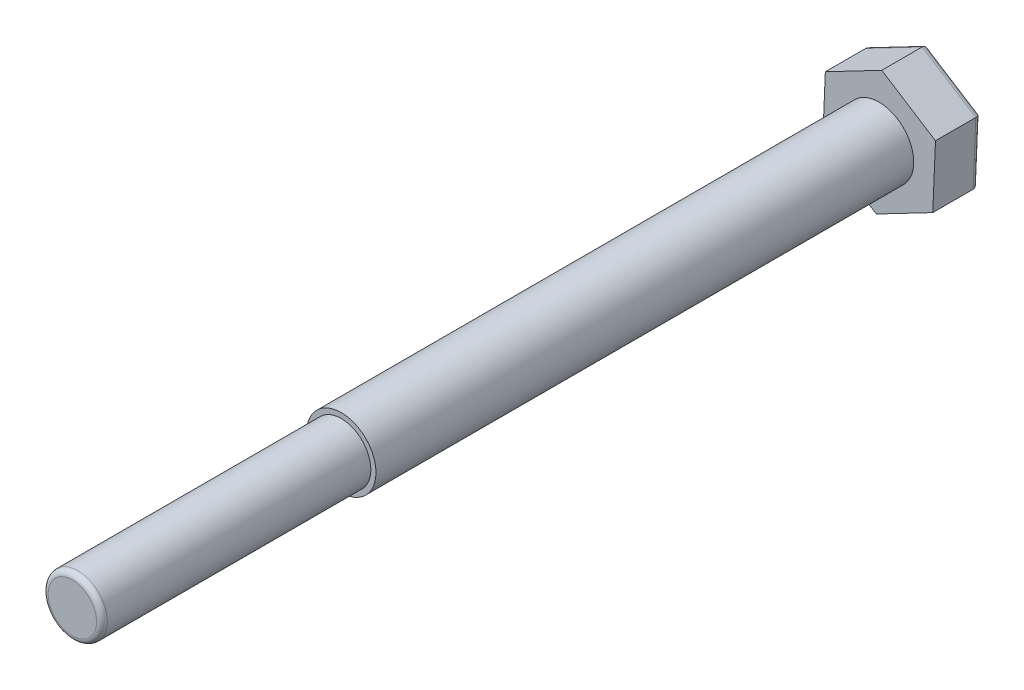
from build123d import *

# Parameters (mm, degrees)
EXTRUDE_275_DEPTH = 17
SKETCH_2_R        = 12.9
EXTRUDE_1_DEPTH   = 200
FILLET_3_R        = 2
SKETCH_3_R        = 11
EXTRUDE_2_DEPTH   = 100
FILLET_4_R        = 2


with BuildPart() as part:
    # 草图1 → Extrude 275 (new body)
    with BuildSketch(Plane.XY):
        Polygon((20.984201837, 10.954296262), (1.005402075, 23.65), (-19.978799762, 12.695703738), (-20.984201837, -10.954296262), (-1.005402075, -23.65), (19.978799762, -12.695703738), align=None)
    extrude(amount=EXTRUDE_275_DEPTH)

    # 草图2 → 凸台-拉伸1 (add)
    with BuildSketch(Plane.XY.offset(17)):
        with Locations(Location((0, 0, 0), (0, 0, 180))):
            Circle(SKETCH_2_R)
    extrude(amount=EXTRUDE_1_DEPTH)

    # 圆角3
    fillet_3_edges = [part.edges().sort_by_distance(p)[0] for p in [
        (9.486698843, -18.172851869, 0),
        (-10.994801956, -17.302148131, 0),
        (-20.4815008, 0.870703738, 0),
        (-9.486698843, 18.172851869, 0),
        (10.994801956, 17.302148131, 0),
        (20.4815008, -0.870703738, 0),
    ]]
    fillet(fillet_3_edges, radius=FILLET_3_R)

    # 草图3 → 凸台-拉伸2 (add)
    with BuildSketch(Plane.XY.offset(217)):
        Circle(SKETCH_3_R)
    extrude(amount=EXTRUDE_2_DEPTH)

    # 圆角4
    fillet_4_edges = [part.edges().sort_by_distance(p)[0] for p in [
        (-11, 0, 317),
    ]]
    fillet(fillet_4_edges, radius=FILLET_4_R)


solid = part.part
